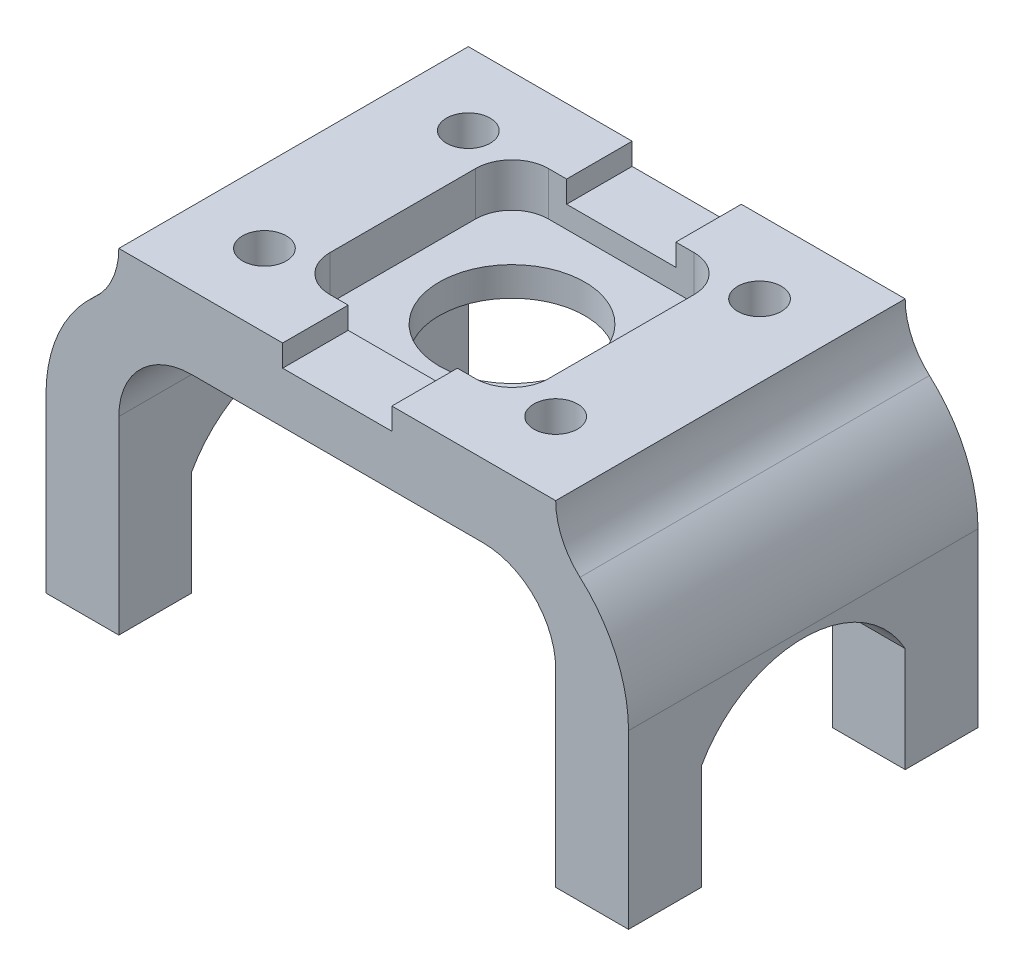
from build123d import *

# Parameters (mm, degrees)
SALIENTE_EXTRUIR1_DEPTH = 1.2
CORTAR_EXTRUIR1_DEPTH   = 0.3
CROQUIS3_R              = 0.5
CORTAR_EXTRUIR2_DEPTH   = 5.630334761
CROQUIS4_R              = 0.15
CORTAR_EXTRUIR3_DEPTH   = 5.767598976
CORTAR_EXTRUIR4_DEPTH   = 5.76759905


with BuildPart() as part:
    # Croquis1 → Saliente-Extruir1 (new, symmetric)
    with BuildSketch(Plane.XY):
        with BuildLine():
            Line((-3.5, 0), (-4, 0))
            Line((-4, 0), (-4, 1.181966011))
            ThreePointArc((-4, 1.181966011), (-3.912870929, 1.590214302), (-3.666666667, 1.927322004))
            ThreePointArc((-3.666666667, 1.927322004), (-3.543564535, 2.095875855), (-3.5, 2.3))
            Line((-3.5, 2.3), (-2.375, 2.3))
            Line((-2.375, 2.3), (-2.375, 2.15))
            Line((-2.375, 2.15), (-1.625, 2.15))
            Line((-1.625, 2.15), (-1.625, 2.3))
            Line((-1.625, 2.3), (-0.5, 2.3))
            ThreePointArc((-0.5, 2.3), (-0.456435465, 2.095875855), (-0.333333333, 1.927322004))
            ThreePointArc((-0.333333333, 1.927322004), (-0.087129071, 1.590214302), (0, 1.181966011))
            Line((0, 1.181966011), (0, 0))
            Line((0, 0), (-0.5, 0))
            Line((-0.5, 0), (-0.5, 1.3))
            ThreePointArc((-0.5, 1.3), (-0.646446609, 1.653553391), (-1, 1.8))
            Line((-1, 1.8), (-3, 1.8))
            ThreePointArc((-3, 1.8), (-3.353553391, 1.653553391), (-3.5, 1.3))
            Line((-3.5, 1.3), (-3.5, 0))
        make_face()
    extrude(amount=SALIENTE_EXTRUIR1_DEPTH, both=True)

    # Croquis2 → Cortar-Extruir1 (cut)
    with BuildSketch(Plane(origin=(0, 2.3, 0), x_dir=(1, 0, 0), z_dir=(0, 1, 0))):
        with BuildLine():
            Line((-2.5, 0.75), (-1.5, 0.75))
            ThreePointArc((-1.5, 0.75), (-1.323223305, 0.676776695), (-1.25, 0.5))
            Line((-1.25, 0.5), (-1.25, -0.5))
            ThreePointArc((-1.25, -0.5), (-1.323223305, -0.676776695), (-1.5, -0.75))
            Line((-1.5, -0.75), (-2.5, -0.75))
            ThreePointArc((-2.5, -0.75), (-2.676776695, -0.676776695), (-2.75, -0.5))
            Line((-2.75, -0.5), (-2.75, 0.5))
            ThreePointArc((-2.75, 0.5), (-2.676776695, 0.676776695), (-2.5, 0.75))
        make_face()
    extrude(amount=-CORTAR_EXTRUIR1_DEPTH, mode=Mode.SUBTRACT)

    # Croquis3 → Cortar-Extruir2 (cut, through all)
    with BuildSketch(Plane(origin=(0, 2, 0), x_dir=(1, 0, 0), z_dir=(0, 1, 0))):
        with Locations(Location((-2, 0, 0), (0, 0, 270))):
            Circle(CROQUIS3_R)
    extrude(amount=-CORTAR_EXTRUIR2_DEPTH, mode=Mode.SUBTRACT)

    # Croquis4 → Cortar-Extruir3 (cut, through all)
    with BuildSketch(Plane(origin=(0, 2.3, 0), x_dir=(1, 0, 0), z_dir=(0, 1, 0))):
        with Locations(Location((-1, 0.7, 0), (0, 0, 270))):
            Circle(CROQUIS4_R)
        with Locations(Location((-3, 0.7, 0), (0, 0, 90))):
            Circle(CROQUIS4_R)
        with Locations(Location((-3, -0.7, 0), (0, 0, 270))):
            Circle(CROQUIS4_R)
        with Locations(Location((-1, -0.7, 0), (0, 0, 90))):
            Circle(CROQUIS4_R)
    extrude(amount=-CORTAR_EXTRUIR3_DEPTH, mode=Mode.SUBTRACT)

    # Croquis5 → Cortar-Extruir4 (cut, through all)
    with BuildSketch(Plane(origin=(0, 0, 0), x_dir=(0, 0, -1), z_dir=(1, 0, 0))):
        with BuildLine():
            Line((-0.7, 0), (0.7, 0))
            Line((0.7, 0), (0.7, 0.72))
            ThreePointArc((0.7, 0.72), (0, 1.132701665), (-0.7, 0.72))
            Line((-0.7, 0.72), (-0.7, 0))
        make_face()
    extrude(amount=-CORTAR_EXTRUIR4_DEPTH, mode=Mode.SUBTRACT)


solid = part.part
